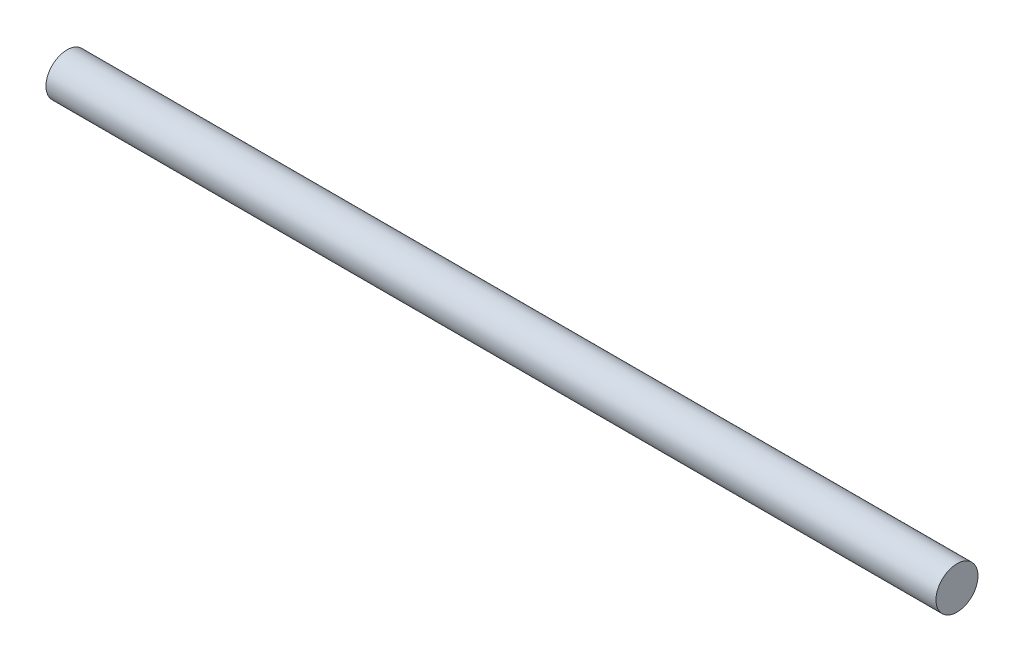
from build123d import *

# Parameters (mm, degrees)
SKETCH1_R           = 0.2921
BOSS_EXTRUDE1_DEPTH = 12.37


with BuildPart() as part:
    # Sketch1 → Boss-Extrude1 (new body)
    with BuildSketch(Plane(origin=(0, 0, 0), x_dir=(0, 0, -1), z_dir=(1, 0, 0))):
        Circle(SKETCH1_R)
    extrude(amount=BOSS_EXTRUDE1_DEPTH)


solid = part.part
